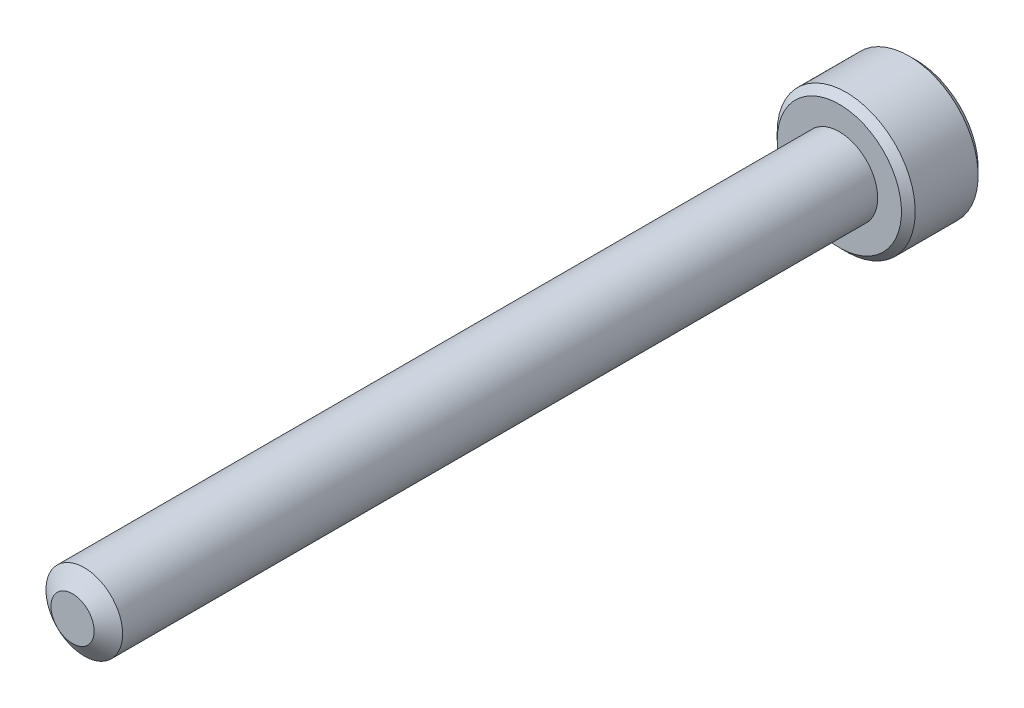
from build123d import *

# Parameters (mm, degrees)
SKETCH1_R          = 1.25
EXTRUDE1_DEPTH     = 25
SKETCH6_R          = 2.25
EXTRUDE2_DEPTH     = 2.5
CUT_EXTRUDE1_DEPTH = 1.5
CHAMFER1_SIZE      = 0.225


with BuildPart() as part:
    # Sketch1 → Extrude1 (new body)
    with BuildSketch(Plane.XY):
        Circle(SKETCH1_R)
    extrude(amount=-EXTRUDE1_DEPTH)

    # Sketch4 → Cut-Revolve1 (revolve, cut)
    with BuildSketch(Plane(origin=(0, 0, 0), x_dir=(0, 0, -1), z_dir=(1, 0, 0))):
        Polygon((0.382511876, 1.25), (0, 0.703716426), (0, 1.25), align=None)
    revolve(axis=Axis((0, 0, 0), (0, 0, -1)), mode=Mode.SUBTRACT)

    # Sketch6 → Extrude2 (add)
    with BuildSketch(Plane(origin=(0, 0, -25), x_dir=(-1, 0, 0), z_dir=(0, 0, -1))):
        Circle(SKETCH6_R)
    extrude(amount=EXTRUDE2_DEPTH)

    # Sketch7 → Cut-Extrude1 (cut)
    with BuildSketch(Plane(origin=(0, 0, -27.5), x_dir=(-1, 0, 0), z_dir=(0, 0, -1))):
        Polygon((0, 1.154700538), (-1, 0.577350269), (-1, -0.577350269), (0, -1.154700538), (1, -0.577350269), (1, 0.577350269), align=None)
    extrude(amount=-CUT_EXTRUDE1_DEPTH, mode=Mode.SUBTRACT)

    # Cut-Extrude2 cone 1 section (through the dimple's axis) → Cut-Extrude2 (revolve, cut)
    with BuildSketch(Plane(origin=(0, 0, -27.5), x_dir=(0, 1, 0), z_dir=(1, 0, 0))):
        Polygon((0, 0), (1.154700538, 0), (0, 1.154700538), align=None)
    revolve(axis=Axis((0, 0, -27.5), (0, 0, 1)), mode=Mode.SUBTRACT)

    # Chamfer1
    chamfer1_edges = [part.edges().sort_by_distance(p)[0] for p in [
        (2.25, 0, -27.5),
        (2.25, 0, -25),
    ]]
    chamfer(chamfer1_edges, length=CHAMFER1_SIZE)


solid = part.part
